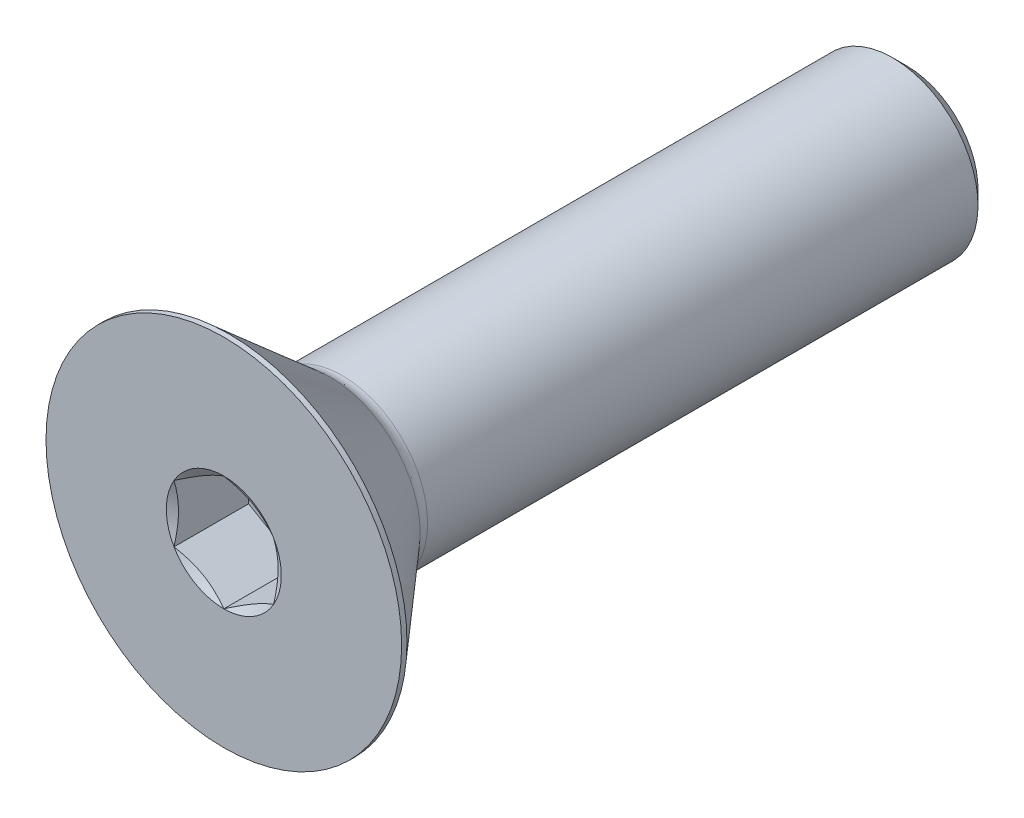
from build123d import *

# Parameters (mm, degrees)
SKETCH1_W          = 38.1
SKETCH1_H          = 4.7625
CHAMFER1_SIZE      = 0.79375
CUT_EXTRUDE2_DEPTH = 4.16052


with BuildPart() as part:
    # Sketch1 → Revolve1 (revolve)
    with BuildSketch(Plane(origin=(0, 0, 0), x_dir=(0, 0, -1), z_dir=(1, 0, 0)), mode=Mode.PRIVATE) as revolve1_sk:
        with Locations((19.05, 2.38125)):
            Rectangle(SKETCH1_W, SKETCH1_H)
    revolve(revolve1_sk.sketch.rotate(Axis((0, 0, -38.1), (0, 0, 1)), 180), axis=Axis((0, 0, -38.1), (0, 0, 1)))

    # Chamfer1
    chamfer1_edges = [part.edges().sort_by_distance(p)[0] for p in [
        (0, 4.7625, -38.1),
    ]]
    chamfer(chamfer1_edges, length=CHAMFER1_SIZE)

    # Sketch7 → Revolve2 (revolve)
    with BuildSketch(Plane(origin=(0, 0, 0), x_dir=(0, 0, -1), z_dir=(1, 0, 0)), mode=Mode.PRIVATE) as revolve2_sk:
        with BuildLine():
            Line((0, 9.9187), (0.29718, 9.9187))
            Line((0.29718, 9.9187), (5.9436, 5.010341978))
            ThreePointArc((5.9436, 5.010341978), (6.252633175, 4.826486559), (6.606483481, 4.7625))
            Line((6.606483481, 4.7625), (6.606483481, 0))
            Line((6.606483481, 0), (0, 0))
            Line((0, 0), (0, 9.9187))
        make_face()
    revolve(revolve2_sk.sketch.rotate(Axis((0, 0, 0), (0, 0, -1)), 180), axis=Axis((0, 0, 0), (0, 0, -1)))

    # Boss-Extrude1 cone 1 section (through the dimple's axis) → Boss-Extrude1 (revolve)
    with BuildSketch(Plane(origin=(0, 0, -6.606483481), x_dir=(0, -1, 0), z_dir=(1, 0, 0))):
        Polygon((0, 0), (4.7625, 0), (0, 4.59909279), align=None)
    revolve(axis=Axis((0, 0, -6.606483481), (0, 0, -1)))

    # Sketch5 → Cut-Extrude2 (cut)
    with BuildSketch(Plane.XY):
        Polygon((0, 3.207902433), (-2.778125, 1.603951217), (-2.778125, -1.603951217), (0, -3.207902433), (2.778125, -1.603951217), (2.778125, 1.603951217), align=None)
    extrude(amount=-CUT_EXTRUDE2_DEPTH, mode=Mode.SUBTRACT)

    # Cut-Extrude3 cone 1 section (through the dimple's axis) → Cut-Extrude3 (revolve, cut)
    with BuildSketch(Plane(origin=(0, 0, 0), x_dir=(0, -1, 0), z_dir=(1, 0, 0))):
        Polygon((0, 0), (3.207902433, 0), (0, 1.852083333), align=None)
    revolve(axis=Axis((0, 0, 0), (0, 0, -1)), mode=Mode.SUBTRACT)


solid = part.part
